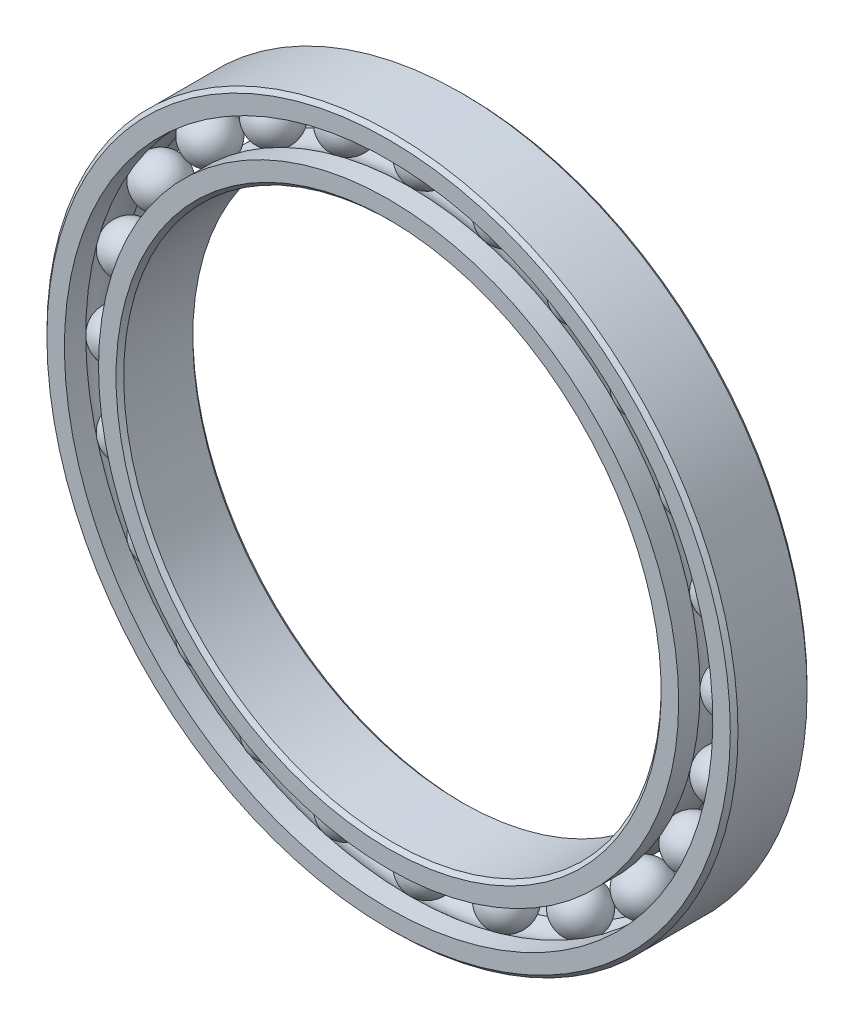
from build123d import *

# Parameters (mm, degrees)
CIRPATTERN1_COUNT = 24


with BuildPart() as part:
    # Sketch6 → Revolve5 (revolve)
    with BuildSketch(Plane(origin=(0, 0, 0), x_dir=(0, 0, -1), z_dir=(1, 0, 0)), mode=Mode.PRIVATE) as revolve5_sk:
        with BuildLine():
            Line((4.5, 45), (5, 44.5))
            Line((5, 44.5), (5, 42.222222222))
            Line((5, 42.222222222), (2.222222222, 42.222222222))
            ThreePointArc((2.222222222, 42.222222222), (0, 43.142696805), (-2.222222222, 42.222222222))
            Line((-2.222222222, 42.222222222), (-5, 42.222222222))
            Line((-5, 42.222222222), (-5, 44.5))
            Line((-5, 44.5), (-4.5, 45))
            Line((-4.5, 45), (4.5, 45))
        make_face()
    revolve(revolve5_sk.sketch.rotate(Axis((0, 0, 5), (0, 0, -1)), 180), axis=Axis((0, 0, 5), (0, 0, -1)))


with BuildPart() as body_2:
    # Sketch3 → Revolve3 (revolve)
    with BuildSketch(Plane(origin=(0, 0, 0), x_dir=(0, 0, -1), z_dir=(1, 0, 0)), mode=Mode.PRIVATE) as revolve3_sk:
        with BuildLine():
            Line((-5, 37.777777778), (-2.222222222, 37.777777778))
            ThreePointArc((-2.222222222, 37.777777778), (0, 36.857303195), (2.222222222, 37.777777778))
            Line((2.222222222, 37.777777778), (5, 37.777777778))
            Line((5, 37.777777778), (5, 35.5))
            Line((5, 35.5), (4.5, 35))
            Line((4.5, 35), (-4.5, 35))
            Line((-4.5, 35), (-5, 35.5))
            Line((-5, 35.5), (-5, 37.777777778))
        make_face()
    revolve(revolve3_sk.sketch.rotate(Axis((0, 0, 5), (0, 0, -1)), 180), axis=Axis((0, 0, 5), (0, 0, -1)))


with BuildPart() as body_3:
    # Sketch4 → Revolve4 (revolve)
    with BuildSketch(Plane(origin=(0, 0, 0), x_dir=(0, 0, -1), z_dir=(1, 0, 0))):
        with BuildLine():
            Line((-3.142696805, 40), (3.142696805, 40))
            ThreePointArc((3.142696805, 40), (0, 43.142696805), (-3.142696805, 40))
        make_face()
    revolve(axis=Axis((0, 40, 3.142696805), (0, 0, -1)))


with BuildPart() as cirpattern1_1:
    # CirPattern1: pattern copy
    add(body_3.part.rotate(Axis((0, 0, 0), (0, 0, 1)), 1 * 360 / CIRPATTERN1_COUNT))


with BuildPart() as cirpattern1_2:
    # CirPattern1: pattern copy
    add(body_3.part.rotate(Axis((0, 0, 0), (0, 0, 1)), 2 * 360 / CIRPATTERN1_COUNT))


with BuildPart() as cirpattern1_3:
    # CirPattern1: pattern copy
    add(body_3.part.rotate(Axis((0, 0, 0), (0, 0, 1)), 3 * 360 / CIRPATTERN1_COUNT))


with BuildPart() as cirpattern1_4:
    # CirPattern1: pattern copy
    add(body_3.part.rotate(Axis((0, 0, 0), (0, 0, 1)), 4 * 360 / CIRPATTERN1_COUNT))


with BuildPart() as cirpattern1_5:
    # CirPattern1: pattern copy
    add(body_3.part.rotate(Axis((0, 0, 0), (0, 0, 1)), 5 * 360 / CIRPATTERN1_COUNT))


with BuildPart() as cirpattern1_6:
    # CirPattern1: pattern copy
    add(body_3.part.rotate(Axis((0, 0, 0), (0, 0, 1)), 6 * 360 / CIRPATTERN1_COUNT))


with BuildPart() as cirpattern1_7:
    # CirPattern1: pattern copy
    add(body_3.part.rotate(Axis((0, 0, 0), (0, 0, 1)), 7 * 360 / CIRPATTERN1_COUNT))


with BuildPart() as cirpattern1_8:
    # CirPattern1: pattern copy
    add(body_3.part.rotate(Axis((0, 0, 0), (0, 0, 1)), 8 * 360 / CIRPATTERN1_COUNT))


with BuildPart() as cirpattern1_9:
    # CirPattern1: pattern copy
    add(body_3.part.rotate(Axis((0, 0, 0), (0, 0, 1)), 9 * 360 / CIRPATTERN1_COUNT))


with BuildPart() as cirpattern1_10:
    # CirPattern1: pattern copy
    add(body_3.part.rotate(Axis((0, 0, 0), (0, 0, 1)), 10 * 360 / CIRPATTERN1_COUNT))


with BuildPart() as cirpattern1_11:
    # CirPattern1: pattern copy
    add(body_3.part.rotate(Axis((0, 0, 0), (0, 0, 1)), 11 * 360 / CIRPATTERN1_COUNT))


with BuildPart() as cirpattern1_12:
    # CirPattern1: pattern copy
    add(body_3.part.rotate(Axis((0, 0, 0), (0, 0, 1)), 12 * 360 / CIRPATTERN1_COUNT))


with BuildPart() as cirpattern1_13:
    # CirPattern1: pattern copy
    add(body_3.part.rotate(Axis((0, 0, 0), (0, 0, 1)), 13 * 360 / CIRPATTERN1_COUNT))


with BuildPart() as cirpattern1_14:
    # CirPattern1: pattern copy
    add(body_3.part.rotate(Axis((0, 0, 0), (0, 0, 1)), 14 * 360 / CIRPATTERN1_COUNT))


with BuildPart() as cirpattern1_15:
    # CirPattern1: pattern copy
    add(body_3.part.rotate(Axis((0, 0, 0), (0, 0, 1)), 15 * 360 / CIRPATTERN1_COUNT))


with BuildPart() as cirpattern1_16:
    # CirPattern1: pattern copy
    add(body_3.part.rotate(Axis((0, 0, 0), (0, 0, 1)), 16 * 360 / CIRPATTERN1_COUNT))


with BuildPart() as cirpattern1_17:
    # CirPattern1: pattern copy
    add(body_3.part.rotate(Axis((0, 0, 0), (0, 0, 1)), 17 * 360 / CIRPATTERN1_COUNT))


with BuildPart() as cirpattern1_18:
    # CirPattern1: pattern copy
    add(body_3.part.rotate(Axis((0, 0, 0), (0, 0, 1)), 18 * 360 / CIRPATTERN1_COUNT))


with BuildPart() as cirpattern1_19:
    # CirPattern1: pattern copy
    add(body_3.part.rotate(Axis((0, 0, 0), (0, 0, 1)), 19 * 360 / CIRPATTERN1_COUNT))


with BuildPart() as cirpattern1_20:
    # CirPattern1: pattern copy
    add(body_3.part.rotate(Axis((0, 0, 0), (0, 0, 1)), 20 * 360 / CIRPATTERN1_COUNT))


with BuildPart() as cirpattern1_21:
    # CirPattern1: pattern copy
    add(body_3.part.rotate(Axis((0, 0, 0), (0, 0, 1)), 21 * 360 / CIRPATTERN1_COUNT))


with BuildPart() as cirpattern1_22:
    # CirPattern1: pattern copy
    add(body_3.part.rotate(Axis((0, 0, 0), (0, 0, 1)), 22 * 360 / CIRPATTERN1_COUNT))


with BuildPart() as cirpattern1_23:
    # CirPattern1: pattern copy
    add(body_3.part.rotate(Axis((0, 0, 0), (0, 0, 1)), 23 * 360 / CIRPATTERN1_COUNT))


solid = Compound([part.part, body_2.part, body_3.part, cirpattern1_1.part, cirpattern1_2.part, cirpattern1_3.part, cirpattern1_4.part, cirpattern1_5.part, cirpattern1_6.part, cirpattern1_7.part, cirpattern1_8.part, cirpattern1_9.part, cirpattern1_10.part, cirpattern1_11.part, cirpattern1_12.part, cirpattern1_13.part, cirpattern1_14.part, cirpattern1_15.part, cirpattern1_16.part, cirpattern1_17.part, cirpattern1_18.part, cirpattern1_19.part, cirpattern1_20.part, cirpattern1_21.part, cirpattern1_22.part, cirpattern1_23.part])
